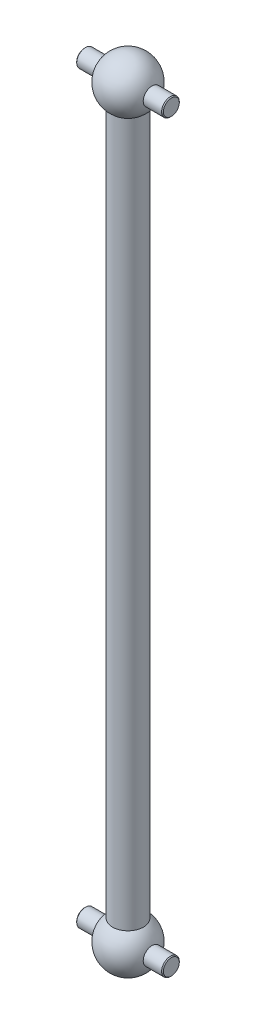
from build123d import *

# Parameters (mm, degrees)
ESQUISSE2_R        = 1
BOSS_EXTRU_1_DEPTH = 4.9
CHANFREIN1_SIZE    = 0.1


with BuildPart() as part:
    # Esquisse1 → Révolution1 (revolve)
    with BuildSketch(Plane.XY, mode=Mode.PRIVATE) as r_volution1_sk:
        with BuildLine():
            Line((-1.75, -39.787533784), (-1.75, 39.787533784))
            ThreePointArc((-1.75, 39.787533784), (-2.749195521, 43.022997284), (0, 45))
            Line((0, 45), (0, -45))
            ThreePointArc((0, -45), (-2.749195521, -43.022997284), (-1.75, -39.787533784))
        make_face()
    revolve(r_volution1_sk.sketch.rotate(Axis((0, 45, 0), (0, -1, 0)), 270), axis=Axis((0, 45, 0), (0, -1, 0)))

    # Esquisse2 → Boss.-Extru.1 (add, symmetric)
    with BuildSketch(Plane(origin=(0, 0, 0), x_dir=(0, 0, -1), z_dir=(1, 0, 0))):
        with Locations((0, 42.1)):
            Circle(ESQUISSE2_R)
    boss_extru_1 = extrude(amount=BOSS_EXTRU_1_DEPTH, both=True)

    # Symétrie3: Boss.-Extru.1 across plane
    add(boss_extru_1.mirror(Plane.ZX))

    # Chanfrein1
    chanfrein1_edges = [part.edges().sort_by_distance(p)[0] for p in [
        (-4.9, 42.1, 1),
        (4.9, 42.1, 1),
        (4.9, -42.1, 1),
        (-4.9, -42.1, 1),
    ]]
    chamfer(chanfrein1_edges, length=CHANFREIN1_SIZE)


solid = part.part
